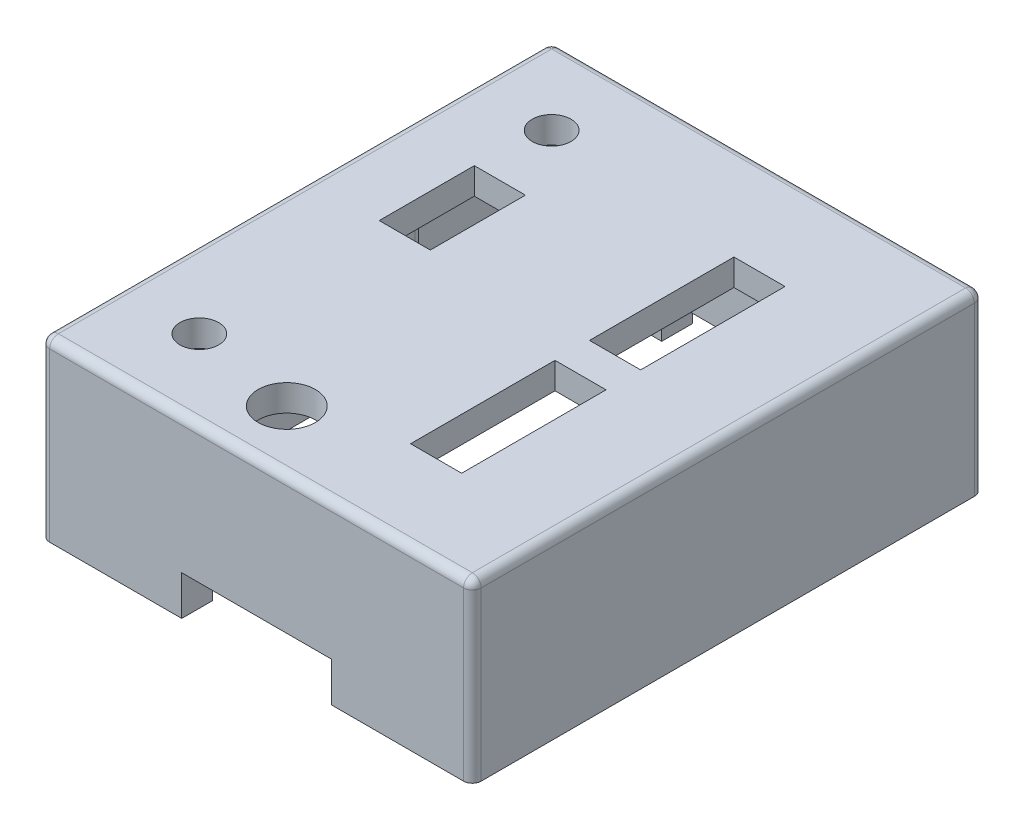
from build123d import *

# Parameters (mm, degrees)
SKETCH2_W           = 24.5
SKETCH2_H           = 29
BOSS_EXTRUDE1_DEPTH = 10
SKETCH3_W           = 21
SKETCH3_H           = 25.5
CUT_EXTRUDE1_DEPTH  = 8.5
SKETCH4_R           = 1.1
SKETCH4_R_2         = 1.625
SKETCH4_W           = 2.9
SKETCH4_H           = 5.4
SKETCH4_H_2         = 8.2
CUT_EXTRUDE2_DEPTH  = 22.454894546
SKETCH5_W           = 8.5
SKETCH5_H           = 2.25
CUT_EXTRUDE3_DEPTH  = 34.031235218
FILLET1_R           = 0.5
SKETCH6_W           = 1.5
SKETCH6_H           = 2
BOSS_EXTRUDE2_DEPTH = 2.7
FILLET2_R           = 0.5


with BuildPart() as part:
    # Sketch2 → Boss-Extrude1 (new body)
    with BuildSketch(Plane(origin=(0, 0, 0), x_dir=(1, 0, 0), z_dir=(0, 1, 0))):
        Rectangle(SKETCH2_W, SKETCH2_H)
    extrude(amount=-BOSS_EXTRUDE1_DEPTH)

    # Sketch3 → Cut-Extrude1 (cut)
    with BuildSketch(Plane.XZ.offset(10)):
        Rectangle(SKETCH3_W, SKETCH3_H)
    extrude(amount=-CUT_EXTRUDE1_DEPTH, mode=Mode.SUBTRACT)

    # Sketch4 → Cut-Extrude2 (cut, through all)
    with BuildSketch(Plane(origin=(0, 0, 0), x_dir=(1, 0, 0), z_dir=(0, 1, 0))):
        with Locations(Location((-7.75, -10, 0), (0, 0, 270))):
            Circle(SKETCH4_R)
        with Locations(Location((-7.75, 10, 0), (0, 0, 270))):
            Circle(SKETCH4_R)
        with Locations(Location((-1.7156, -11.0712, 0), (0, 0, 270))):
            Circle(SKETCH4_R_2)
        with Locations((-6.7576, 3.3688)):
            Rectangle(SKETCH4_W, SKETCH4_H)
        with Locations((5.1042, 4.84677)):
            Rectangle(SKETCH4_W, SKETCH4_H_2)
        with Locations((5.1042, -5.31323)):
            Rectangle(SKETCH4_W, SKETCH4_H_2)
    extrude(amount=-CUT_EXTRUDE2_DEPTH, mode=Mode.SUBTRACT)

    # Sketch5 → Cut-Extrude3 (cut, through all)
    with BuildSketch(Plane.XY.offset(14.5)):
        with Locations((0, -8.875)):
            Rectangle(SKETCH5_W, SKETCH5_H)
    extrude(amount=-CUT_EXTRUDE3_DEPTH, mode=Mode.SUBTRACT)

    # Fillet1
    fillet1_edges = [part.edges().sort_by_distance(p)[0] for p in [
        (0, 0, -14.5),
        (12.25, 0, 0),
        (0, 0, 14.5),
        (-12.25, 0, 0),
        (-12.25, -5, -14.5),
        (12.25, -5, -14.5),
        (12.25, -5, 14.5),
        (-12.25, -5, 14.5),
    ]]
    fillet(fillet1_edges, radius=FILLET1_R)

    # Sketch6 → Boss-Extrude2 (add)
    with BuildSketch(Plane.XZ.offset(1.5)):
        with Locations((-9.75, -3)):
            Rectangle(SKETCH6_W, SKETCH6_H)
        with Locations((9.75, 6.5)):
            Rectangle(SKETCH6_W, SKETCH6_H)
        with Locations((9.75, -5.5)):
            Rectangle(SKETCH6_W, SKETCH6_H)
    extrude(amount=BOSS_EXTRUDE2_DEPTH)

    # Fillet2
    fillet2_edges = [part.edges().sort_by_distance(p)[0] for p in [
        (-9.75, -1.5, -2),
        (9.75, -1.5, -6.5),
        (9.75, -1.5, 5.5),
        (-9, -1.5, -3),
        (9, -1.5, -5.5),
        (9, -1.5, 6.5),
        (-9.75, -1.5, -4),
        (-10.5, -2.85, -4),
        (-9, -2.85, -4),
        (-9, -2.85, -2),
        (-10.5, -2.85, -2),
        (9.75, -1.5, -4.5),
        (10.5, -2.85, -4.5),
        (9, -2.85, -4.5),
        (9, -2.85, -6.5),
        (10.5, -2.85, -6.5),
        (9.75, -1.5, 7.5),
        (10.5, -2.85, 7.5),
        (9, -2.85, 7.5),
        (9, -2.85, 5.5),
        (10.5, -2.85, 5.5),
    ]]
    fillet(fillet2_edges, radius=FILLET2_R)


solid = part.part
